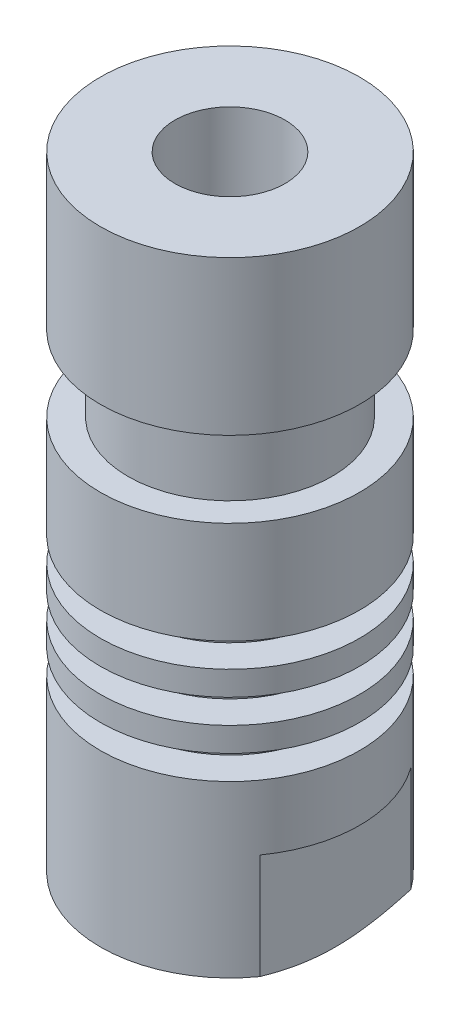
from build123d import *

# Parameters (mm, degrees)
TAGLIO_ESTRUSIONE1_REACH                  = 43.569
TAGLIO_ESTRUSIONE1_END_RADIUS             = 8
SCHIZZO2_W                                = 1.5
SCHIZZO2_H                                = 8
TAGLIO_ESTRUSIONE1_DIRECTION_2_REACH      = 43.569
TAGLIO_ESTRUSIONE1_DIRECTION_2_END_RADIUS = 8
FORO_FILETTATO_M8_1_D                     = 6.8


with BuildPart() as part:
    # Schizzo1 → Rivoluzione1 (revolve)
    with BuildSketch(Plane.XY, mode=Mode.PRIVATE) as rivoluzione1_sk:
        Polygon((0, 0), (-5, 0), (-8, 1.5), (-8, 12), (-6, 12), (-6, 13.5), (-8, 13.5), (-8, 15), (-6, 15), (-6, 16.5), (-8, 16.5), (-8, 18), (-6, 18), (-6, 19.5), (-8, 19.5), (-8, 25.8), (-6.3, 25.8), (-6.3, 30.5), (-8, 30.5), (-8, 40), (0, 40), align=None)
    revolve(rivoluzione1_sk.sketch.rotate(Axis((0, 129.407380346, 0), (0, -1, 0)), 270), axis=Axis((0, 129.407380346, 0), (0, -1, 0)))

    # Taglio-Estrusione1: up to this cylinder (the profile starts inside it)
    taglio_estrusione1_end = Plane(origin=(0, 4, 0), z_dir=(0, 1, 0)) * Cylinder(TAGLIO_ESTRUSIONE1_END_RADIUS, 104.138, mode=Mode.PRIVATE)
    # Schizzo2 → Taglio-Estrusione1 (cut, up to the surface)
    with BuildSketch(Plane.XY, mode=Mode.PRIVATE) as taglio_estrusione1_sk1:
        with Locations((-7.25, 4)):
            Rectangle(SCHIZZO2_W, SCHIZZO2_H)
    taglio_estrusione1_tool1 = extrude(taglio_estrusione1_sk1.sketch, amount=-TAGLIO_ESTRUSIONE1_REACH, mode=Mode.PRIVATE) & taglio_estrusione1_end
    add(taglio_estrusione1_tool1.solids().sort_by_distance((-7.25, 4, 0))[0], mode=Mode.SUBTRACT)
    # Schizzo2 → Taglio-Estrusione1 (cut, up to the surface)
    with BuildSketch(Plane.XY, mode=Mode.PRIVATE) as taglio_estrusione1_sk2:
        with Locations((7.25, 4)):
            Rectangle(SCHIZZO2_W, SCHIZZO2_H)
    taglio_estrusione1_tool2 = extrude(taglio_estrusione1_sk2.sketch, amount=-TAGLIO_ESTRUSIONE1_REACH, mode=Mode.PRIVATE) & taglio_estrusione1_end
    add(taglio_estrusione1_tool2.solids().sort_by_distance((7.25, 4, 0))[0], mode=Mode.SUBTRACT)

    # Taglio-Estrusione1 direction 2: up to this cylinder (the profile starts inside it)
    taglio_estrusione1_direction_2_end = Plane(origin=(0, 4, 0), z_dir=(0, 1, 0)) * Cylinder(TAGLIO_ESTRUSIONE1_DIRECTION_2_END_RADIUS, 104.138, mode=Mode.PRIVATE)
    # Schizzo2 → Taglio-Estrusione1 direction 2 (cut, up to the surface)
    with BuildSketch(Plane.XY, mode=Mode.PRIVATE) as taglio_estrusione1_direction_2_sk1:
        with Locations((-7.25, 4)):
            Rectangle(SCHIZZO2_W, SCHIZZO2_H)
    taglio_estrusione1_direction_2_tool1 = extrude(taglio_estrusione1_direction_2_sk1.sketch, amount=TAGLIO_ESTRUSIONE1_DIRECTION_2_REACH, mode=Mode.PRIVATE) & taglio_estrusione1_direction_2_end
    add(taglio_estrusione1_direction_2_tool1.solids().sort_by_distance((-7.25, 4, 0))[0], mode=Mode.SUBTRACT)
    # Schizzo2 → Taglio-Estrusione1 direction 2 (cut, up to the surface)
    with BuildSketch(Plane.XY, mode=Mode.PRIVATE) as taglio_estrusione1_direction_2_sk2:
        with Locations((7.25, 4)):
            Rectangle(SCHIZZO2_W, SCHIZZO2_H)
    taglio_estrusione1_direction_2_tool2 = extrude(taglio_estrusione1_direction_2_sk2.sketch, amount=TAGLIO_ESTRUSIONE1_DIRECTION_2_REACH, mode=Mode.PRIVATE) & taglio_estrusione1_direction_2_end
    add(taglio_estrusione1_direction_2_tool2.solids().sort_by_distance((7.25, 4, 0))[0], mode=Mode.SUBTRACT)

    # Foro filettato M8-1 (through all)
    with Locations(Plane(origin=(0, 40, 0), x_dir=(1, 0, 0), z_dir=(0, 1, 0))):
        with Locations((0, 0)):
            Hole(FORO_FILETTATO_M8_1_D / 2)


solid = part.part
